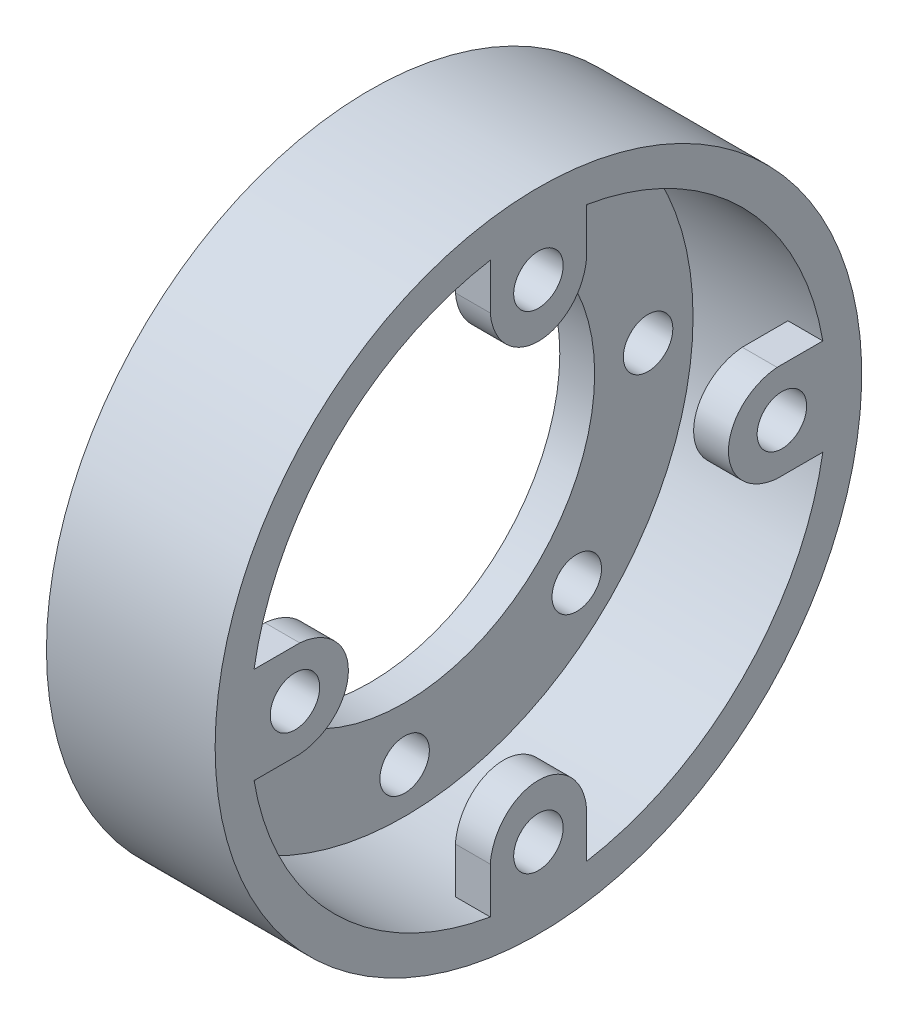
from build123d import *

# Parameters (mm, degrees)
SKETCH1_R           = 65.151
SKETCH1_R_2         = 42.926
BOSS_EXTRUDE2_DEPTH = 7.874
SKETCH1_5_R         = 73.025
SKETCH1_5_R_2       = 65.151
BOSS_EXTRUDE3_DEPTH = 38.1
SKETCH24_R          = 5.588
CUT_EXTRUDE1_DEPTH  = 38.1
CIRPATTERN3_COUNT   = 8
BOSS_EXTRUDE7_START = -7.874
BOSS_EXTRUDE7_DEPTH = 7.874
SKETCH35_R          = 5.588
CUT_EXTRUDE2_DEPTH  = 111.076842611
CIRPATTERN9_COUNT   = 4


with BuildPart() as part:
    # Sketch1 → Boss-Extrude2 (new body)
    with BuildSketch(Plane(origin=(0, 0, 0), x_dir=(0, 0, -1), z_dir=(1, 0, 0))):
        Circle(SKETCH1_R)
        Circle(SKETCH1_R_2, mode=Mode.SUBTRACT)
    extrude(amount=BOSS_EXTRUDE2_DEPTH)

    # Sketch1<5> → Boss-Extrude3 (add)
    with BuildSketch(Plane(origin=(0, 0, 0), x_dir=(0, 0, -1), z_dir=(1, 0, 0))):
        Circle(SKETCH1_5_R)
        Circle(SKETCH1_5_R_2, mode=Mode.SUBTRACT)
    extrude(amount=BOSS_EXTRUDE3_DEPTH)

    # Sketch24 → Cut-Extrude1 (cut)
    with BuildSketch(Plane(origin=(7.874, 0, 0), x_dir=(0, 0, -1), z_dir=(1, 0, 0))):
        with Locations((0, 54.991)):
            Circle(SKETCH24_R)
    cut_extrude1 = extrude(amount=-CUT_EXTRUDE1_DEPTH, mode=Mode.SUBTRACT)

    # CirPattern3: Cut-Extrude1 ×8 about axis
    cirpattern3_axis = Axis((7.874, 0, 0), (1, 0, 0))
    for i in range(1, CIRPATTERN3_COUNT):
        add(cut_extrude1.rotate(cirpattern3_axis, i * 360 / CIRPATTERN3_COUNT), mode=Mode.SUBTRACT)

    # Sketch34 → Boss-Extrude7 (add)
    with BuildSketch(Plane(origin=(38.1, 0, 0), x_dir=(0, 0, -1), z_dir=(1, 0, 0)).offset(BOSS_EXTRUDE7_START)):
        with BuildLine():
            Line((10.881292196, -53.903687825), (10.881292196, -64.235895581))
            ThreePointArc((10.881292196, -64.235895581), (0, -65.151), (-10.881292196, -64.235895581))
            Line((-10.881292196, -64.235895581), (-10.881292196, -53.903687825))
            add(Edge.make_bspline(
                [(10.881292196, -53.903687825), (9.981727061, -42.926), (0, -42.926), (-9.981727061, -42.926), (-10.881292196, -53.903687825)],
                knots=[1.661039958, 1.661039958, 1.661039958, 3.141592654, 3.141592654, 4.622145349, 4.622145349, 4.622145349], degree=2, weights=[1, 0.738282192, 1, 0.738282192, 1]))
        make_face()
    boss_extrude7 = extrude(amount=BOSS_EXTRUDE7_DEPTH)

    # Sketch35 → Cut-Extrude2 (cut, through all)
    with BuildSketch(Plane(origin=(38.1, 0, 0), x_dir=(0, 0, -1), z_dir=(1, 0, 0))):
        with Locations((0, -54.991)):
            Circle(SKETCH35_R)
    cut_extrude2 = extrude(amount=-CUT_EXTRUDE2_DEPTH, mode=Mode.SUBTRACT)

    # CirPattern9: Boss-Extrude7, Cut-Extrude2 ×4 about axis
    cirpattern9_axis = Axis((38.1, 0, 0), (-1, 0, 0))
    add([boss_extrude7.rotate(cirpattern9_axis, i * 360 / CIRPATTERN9_COUNT) for i in range(1, CIRPATTERN9_COUNT)])
    add([cut_extrude2.rotate(cirpattern9_axis, i * 360 / CIRPATTERN9_COUNT) for i in range(1, CIRPATTERN9_COUNT)], mode=Mode.SUBTRACT)


solid = part.part
